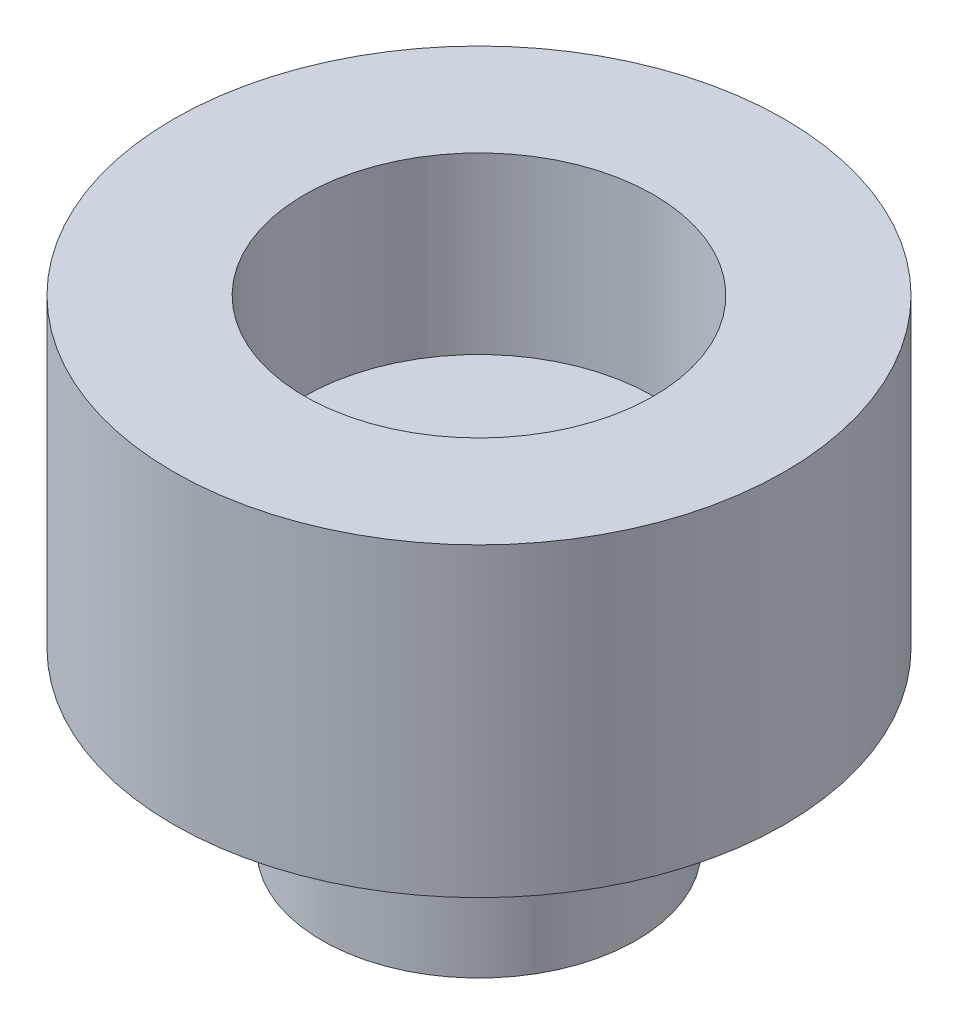
from build123d import *


with BuildPart() as part:
    # Esquisse1 → Révolution1 (revolve)
    with BuildSketch(Plane.XY, mode=Mode.PRIVATE) as r_volution1_sk:
        Polygon((0, 0), (0, 3.5), (2, 3.5), (2, 5.5), (3.5, 5.5), (3.5, 2), (1.8, 2), (1.8, 0), align=None)
    revolve(r_volution1_sk.sketch.rotate(Axis((0, 0, 0), (0, 1, 0)), 90), axis=Axis((0, 0, 0), (0, 1, 0)))


solid = part.part
